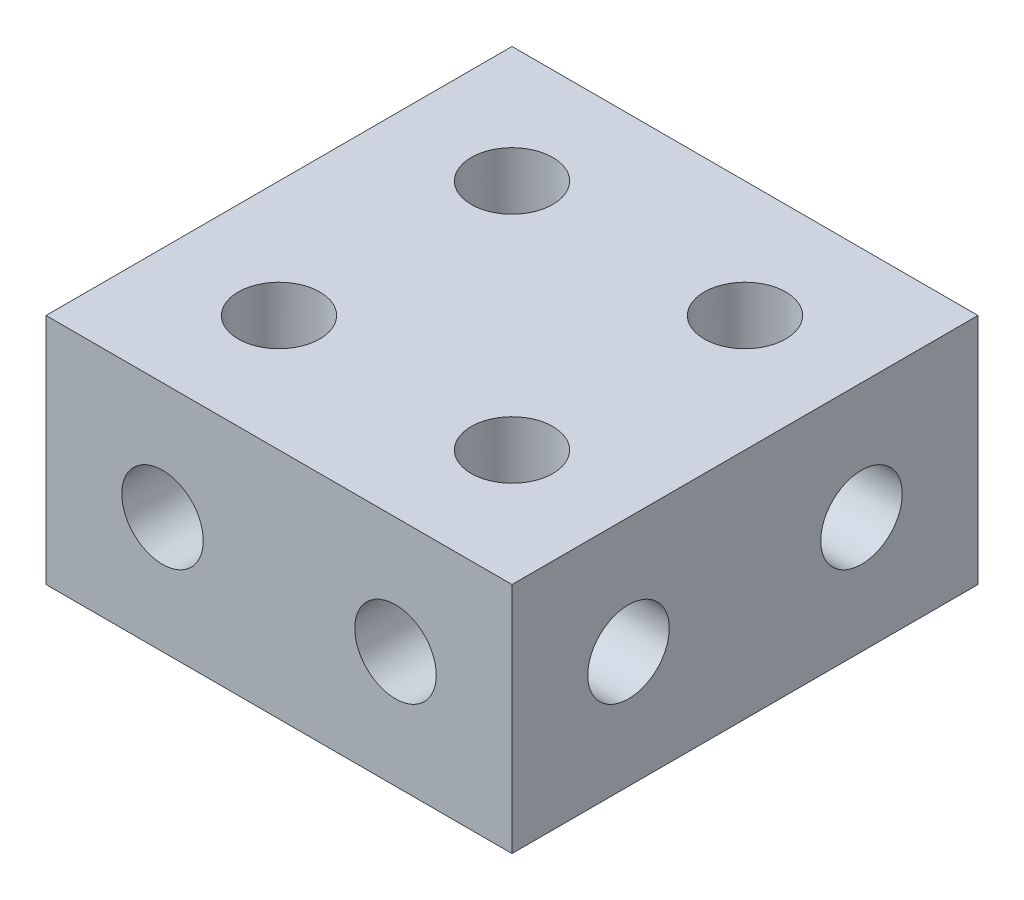
from build123d import *

# Parameters (mm, degrees)
ESQUISSE1_W             = 20
ESQUISSE1_H             = 10
BOSS_EXTRU_1_DEPTH      = 20
ESQUISSE2_R             = 1.75
ENL_V_MAT_EXTRU_1_DEPTH = 31
ESQUISSE3_R             = 1.75
ENL_V_MAT_EXTRU_2_DEPTH = 40
ESQUISSE4_R             = 1.75
ENL_V_MAT_EXTRU_3_DEPTH = 40


with BuildPart() as part:
    # Esquisse1 → Boss.-Extru.1 (new body)
    with BuildSketch(Plane(origin=(0, 0, 0), x_dir=(0, 0, -1), z_dir=(1, 0, 0))):
        with Locations((10, 5)):
            Rectangle(ESQUISSE1_W, ESQUISSE1_H)
    extrude(amount=BOSS_EXTRU_1_DEPTH)

    # Esquisse2 → Enlèv. mat.-Extru.1 (cut, through all)
    with BuildSketch(Plane(origin=(0, 10, 0), x_dir=(1, 0, 0), z_dir=(0, 1, 0))):
        with Locations(Location((5, 15, 0), (0, 0, 270))):
            Circle(ESQUISSE2_R)
        with Locations(Location((15, 15, 0), (0, 0, 270))):
            Circle(ESQUISSE2_R)
        with Locations((25, 15)):
            Circle(ESQUISSE2_R)
        with Locations((35, 15)):
            Circle(ESQUISSE2_R)
        with Locations(Location((5, 5, 0), (0, 0, 270))):
            Circle(ESQUISSE2_R)
        with Locations(Location((15, 5, 0), (0, 0, 270))):
            Circle(ESQUISSE2_R)
        with Locations((25, 5)):
            Circle(ESQUISSE2_R)
        with Locations((35, 5)):
            Circle(ESQUISSE2_R)
        with Locations((5, -5)):
            Circle(ESQUISSE2_R)
        with Locations((15, -5)):
            Circle(ESQUISSE2_R)
        with Locations((25, -5)):
            Circle(ESQUISSE2_R)
        with Locations((35, -5)):
            Circle(ESQUISSE2_R)
        with Locations((5, -15)):
            Circle(ESQUISSE2_R)
        with Locations((15, -15)):
            Circle(ESQUISSE2_R)
        with Locations((25, -15)):
            Circle(ESQUISSE2_R)
        with Locations((35, -15)):
            Circle(ESQUISSE2_R)
    extrude(amount=-ENL_V_MAT_EXTRU_1_DEPTH, mode=Mode.SUBTRACT)

    # Esquisse3 → Enlèv. mat.-Extru.2 (cut)
    with BuildSketch(Plane.XY):
        with Locations((5, 5)):
            Circle(ESQUISSE3_R)
        with Locations((15, 5)):
            Circle(ESQUISSE3_R)
        with Locations((25, 5)):
            Circle(ESQUISSE3_R)
        with Locations((35, 5)):
            Circle(ESQUISSE3_R)
    extrude(amount=-ENL_V_MAT_EXTRU_2_DEPTH, mode=Mode.SUBTRACT)

    # Esquisse4 → Enlèv. mat.-Extru.3 (cut)
    with BuildSketch(Plane(origin=(20, 0, 0), x_dir=(0, 0, -1), z_dir=(1, 0, 0))):
        with Locations((5, 5)):
            Circle(ESQUISSE4_R)
        with Locations(Location((15, 5, 0), (0, 0, 315))):
            Circle(ESQUISSE4_R)
        with Locations((25, 5)):
            Circle(ESQUISSE4_R)
        with Locations((35, 5)):
            Circle(ESQUISSE4_R)
    extrude(amount=-ENL_V_MAT_EXTRU_3_DEPTH, mode=Mode.SUBTRACT)


solid = part.part
